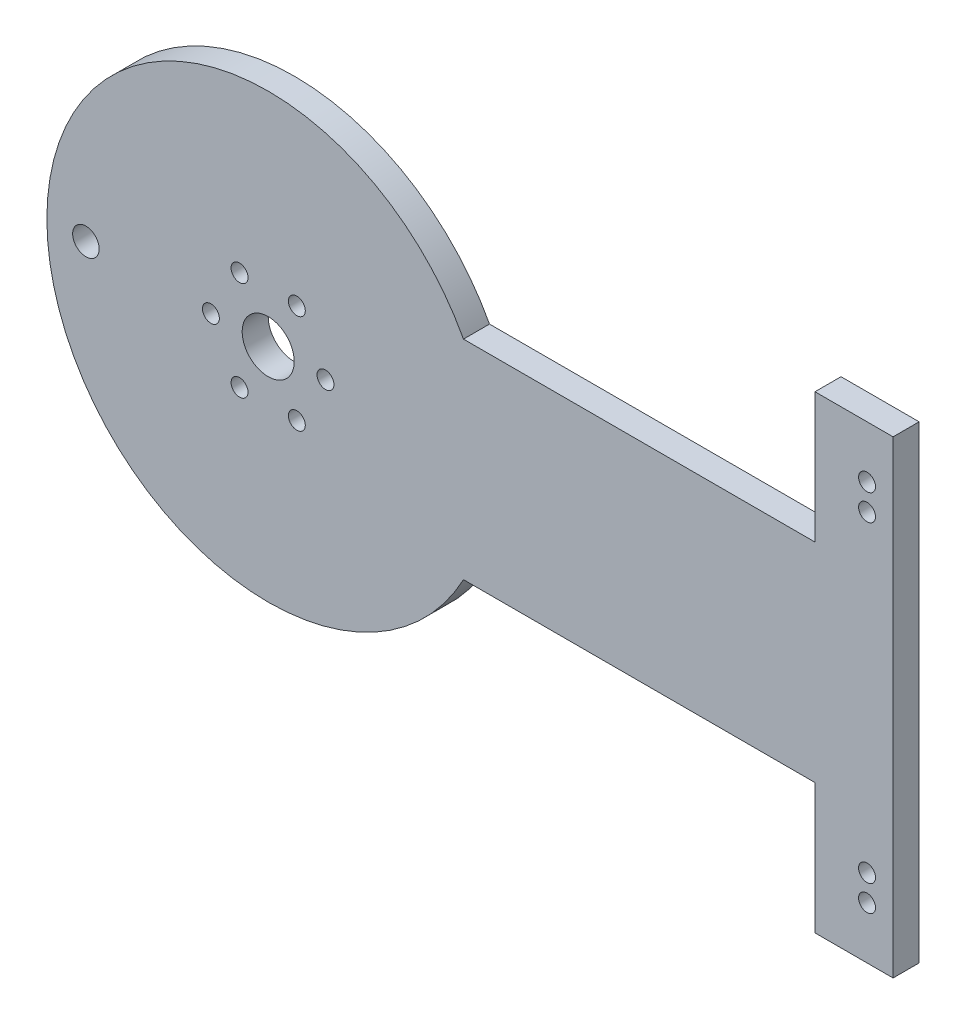
from build123d import *

# Parameters (mm, degrees)
SKETCH_1_R          = 85
EXTRUDE_1_DEPTH     = 10
SKETCH_2_W          = 240
SKETCH_2_H          = 80
EXTRUDE_2_DEPTH     = 10
SKETCH_3_W          = 30
SKETCH_3_H          = 180
EXTRUDE_3_DEPTH     = 10
SKETCH_4_R          = 10
SKETCH_4_R_2        = 3.25
SKETCH_4_R_3        = 5.1
CUT_EXTRUDE_1_DEPTH = 11


with BuildPart() as part:
    # 草图1 → 凸台-拉伸1 (new body)
    with BuildSketch(Plane.XY):
        Circle(SKETCH_1_R)
    extrude(amount=EXTRUDE_1_DEPTH)

    # 草图2 → 凸台-拉伸2 (add)
    with BuildSketch(Plane.XY):
        with Locations((120, 0)):
            Rectangle(SKETCH_2_W, SKETCH_2_H)
    extrude(amount=EXTRUDE_2_DEPTH)

    # 草图3 → 凸台-拉伸3 (add)
    with BuildSketch(Plane.XY):
        with Locations((225, 0)):
            Rectangle(SKETCH_3_W, SKETCH_3_H)
    extrude(amount=EXTRUDE_3_DEPTH)

    # 草图4 → 切除-拉伸1 (cut)
    with BuildSketch(Plane(origin=(0, 0, 0), x_dir=(-1, 0, 0), z_dir=(0, 0, -1))):
        Circle(SKETCH_4_R)
        with Locations((-22, 0)):
            Circle(SKETCH_4_R_2)
        with Locations((-11, 19.052558883)):
            Circle(SKETCH_4_R_2)
        with Locations((11, 19.052558883)):
            Circle(SKETCH_4_R_2)
        with Locations((22, 0)):
            Circle(SKETCH_4_R_2)
        with Locations((11, -19.052558883)):
            Circle(SKETCH_4_R_2)
        with Locations((-11, -19.052558883)):
            Circle(SKETCH_4_R_2)
        with Locations((-230, -70)):
            Circle(SKETCH_4_R_2)
        with Locations((-230, -60)):
            Circle(SKETCH_4_R_2)
        with Locations((-230, 60)):
            Circle(SKETCH_4_R_2)
        with Locations((-230, 70)):
            Circle(SKETCH_4_R_2)
        with Locations((70, 0)):
            Circle(SKETCH_4_R_3)
    extrude(amount=-CUT_EXTRUDE_1_DEPTH, mode=Mode.SUBTRACT)


solid = part.part
